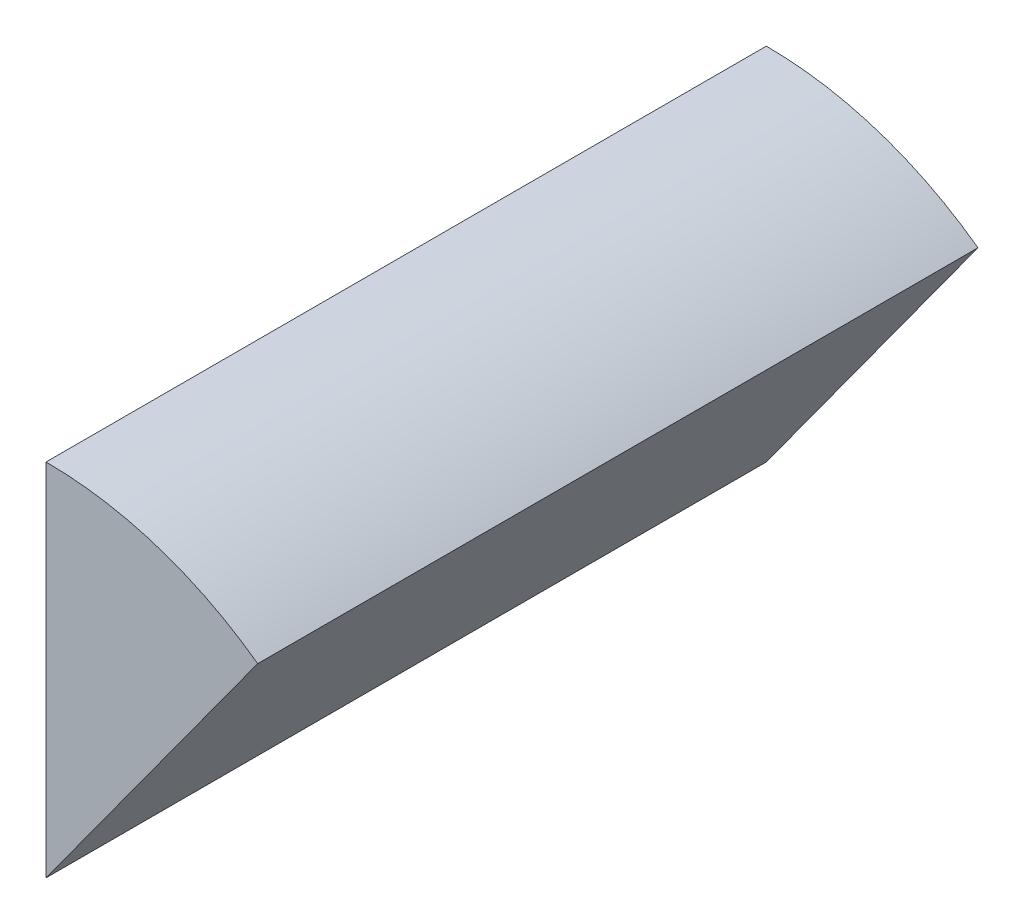
from build123d import *

# Parameters (mm, degrees)
SALIENTE_EXTRUIR1_DEPTH = 50
CROQUIS2_R              = 4.963681779
CORTAR_EXTRUIR1_DEPTH   = 10


with BuildPart() as part:
    # Croquis1 → Saliente-Extruir1 (new body)
    with BuildSketch(Plane.XY):
        with BuildLine():
            Line((0, 25), (0, 0))
            Line((0, 0), (14.694631307, 20.225424859))
            ThreePointArc((14.694631307, 20.225424859), (7.725424859, 23.776412907), (0, 25))
        make_face()
    extrude(amount=SALIENTE_EXTRUIR1_DEPTH)

    # Croquis2 → Cortar-Extruir1 (cut)
    with BuildSketch(Plane(origin=(0, 0, 0), x_dir=(-1, 0, 0), z_dir=(0, 0, -1))):
        with Locations((-5.749609503, 18.339235574)):
            Circle(CROQUIS2_R)
    extrude(amount=-CORTAR_EXTRUIR1_DEPTH, mode=Mode.SUBTRACT)


solid = part.part
